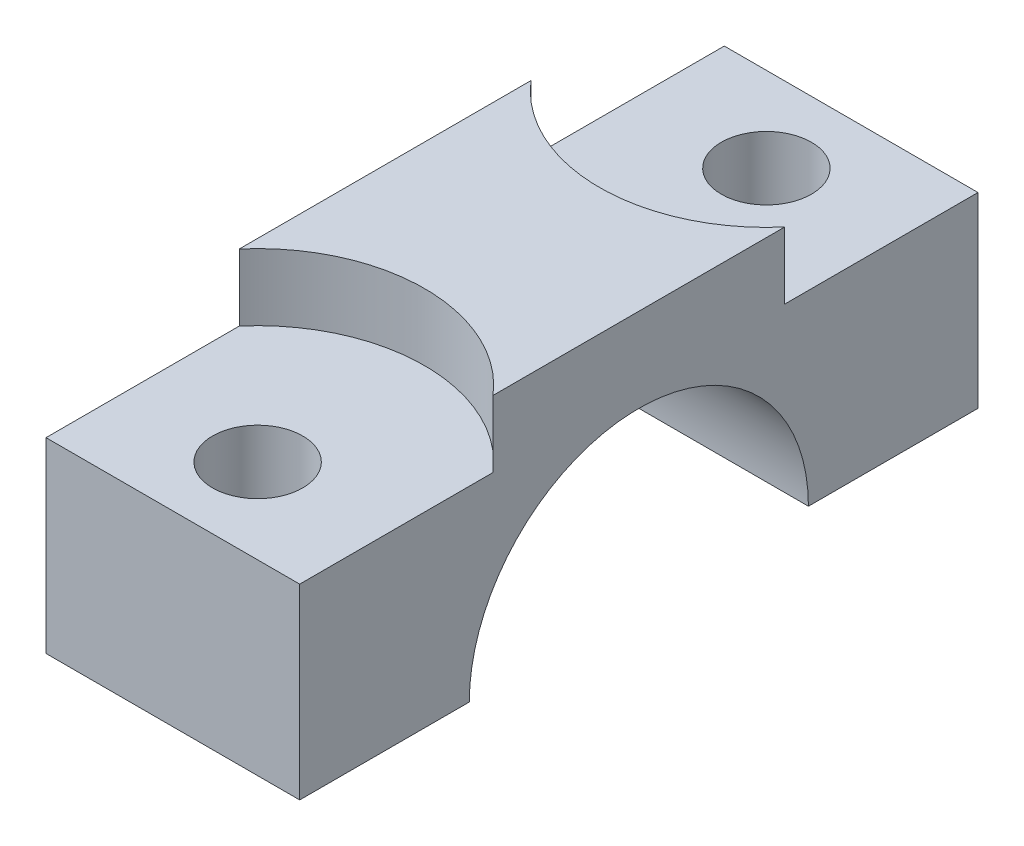
from build123d import *

# Parameters (mm, degrees)
BOSS_EXTRUDE1_DEPTH                           = 9.5
CBORE_FOR_M12_HEX_HEAD_CAP_SCREW1_D           = 6.75
CBORE_FOR_M12_HEX_HEAD_CAP_SCREW1_CBORE_D     = 25
CBORE_FOR_M12_HEX_HEAD_CAP_SCREW1_CBORE_DEPTH = 5


with BuildPart() as part:
    # Sketch1 → Boss-Extrude1 (new, symmetric)
    with BuildSketch(Plane(origin=(0, 0, 0), x_dir=(0, 0, -1), z_dir=(1, 0, 0))):
        with BuildLine():
            Line((25.4, 19), (-25.4, 19))
            Line((-25.4, 19), (-25.4, 0))
            Line((-25.4, 0), (-12.7, 0))
            ThreePointArc((-12.7, 0), (0, 12.7), (12.7, 0))
            Line((12.7, 0), (25.4, 0))
            Line((25.4, 0), (25.4, 19))
        make_face()
    extrude(amount=BOSS_EXTRUDE1_DEPTH, both=True)

    # CBORE for M12 Hex Head Cap Screw1 (through all)
    with Locations(Plane(origin=(0, 19, 0), x_dir=(1, 0, 0), z_dir=(0, 1, 0))):
        with Locations((0, -19.05), (0, 19.05)):
            CounterBoreHole(CBORE_FOR_M12_HEX_HEAD_CAP_SCREW1_D / 2, CBORE_FOR_M12_HEX_HEAD_CAP_SCREW1_CBORE_D / 2, CBORE_FOR_M12_HEX_HEAD_CAP_SCREW1_CBORE_DEPTH)


solid = part.part
